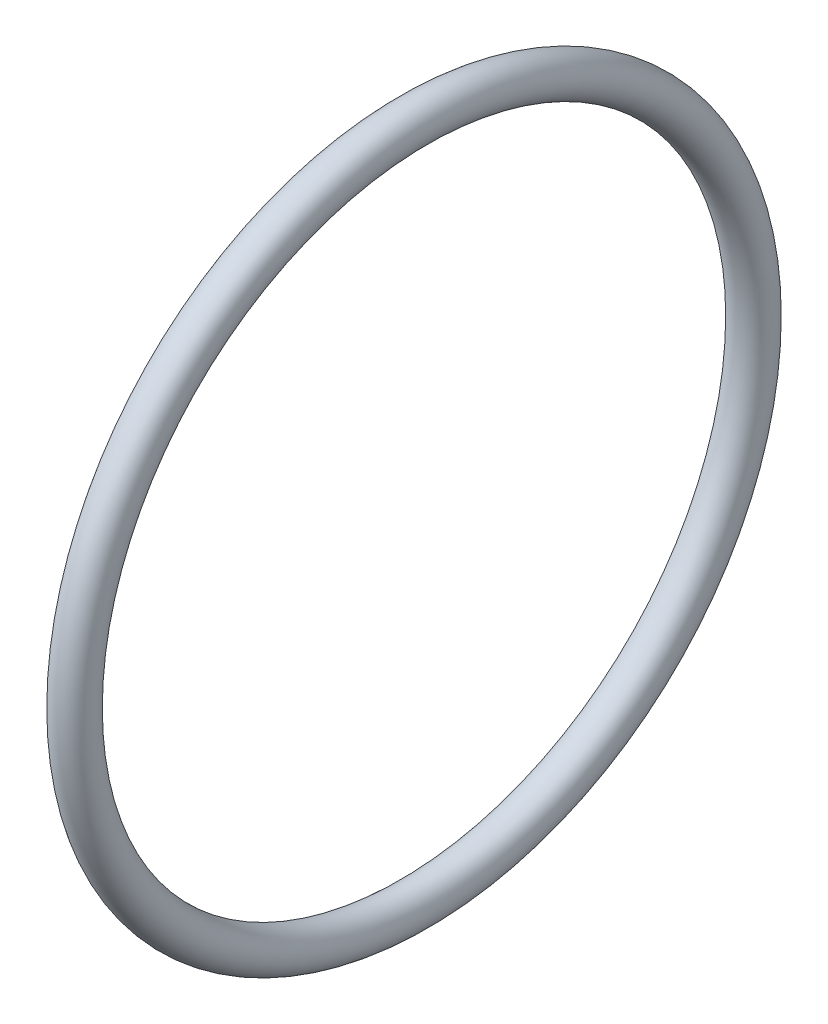
from build123d import *

# Parameters (mm, degrees)
SKETCH1_R = 1


with BuildPart() as part:
    # Sketch1 → Revolve1 (revolve)
    with BuildSketch(Plane.XY, mode=Mode.PRIVATE) as revolve1_sk:
        with Locations((0, 17.275)):
            Circle(SKETCH1_R)
    revolve(revolve1_sk.sketch.rotate(Axis((0, 0, 0), (1, 0, 0)), 90), axis=Axis((0, 0, 0), (1, 0, 0)))


solid = part.part
